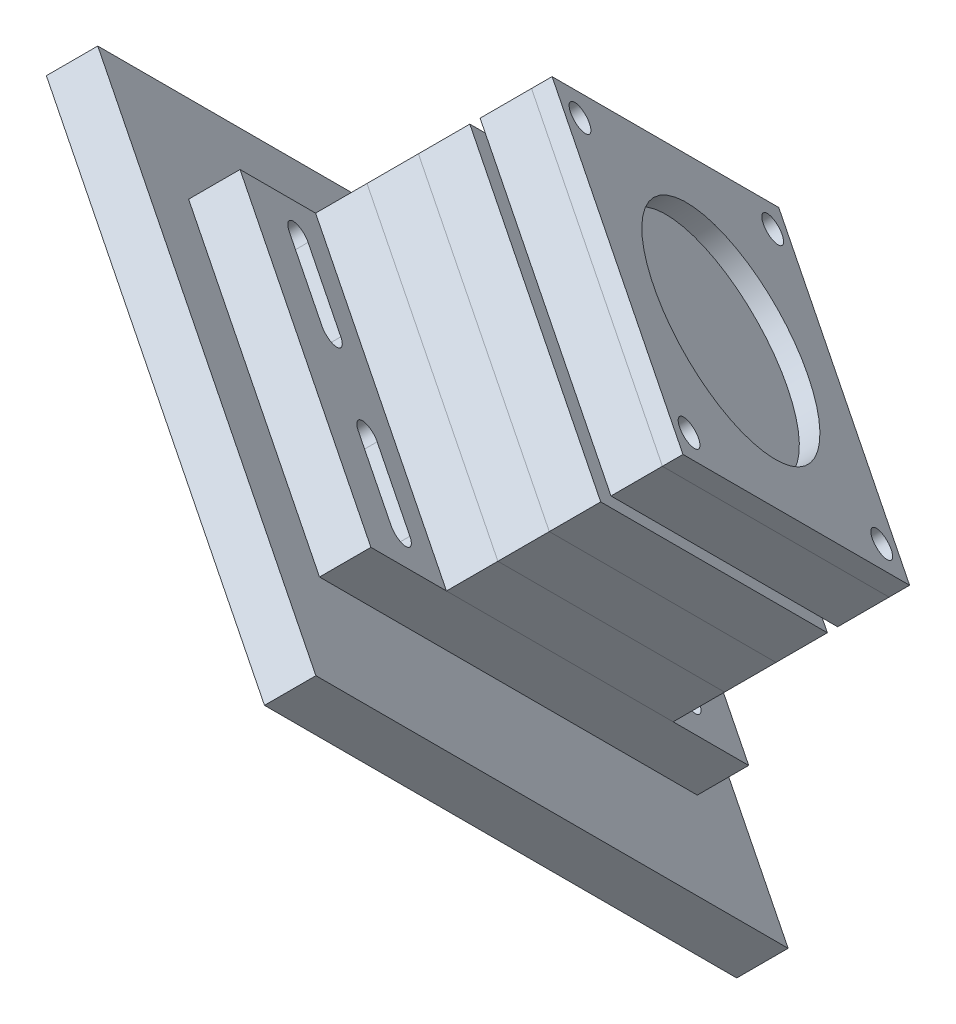
from build123d import *

# Parameters (mm, degrees)
SKETCH1_W            = 80
SKETCH1_H            = 80
BOSS_EXTRUDE1_DEPTH  = 80
SKETCH2_R            = 97.950709898
CUT_EXTRUDE1_DEPTH   = 93.37604307
SKETCH3_R            = 78.302577254
SKETCH3_R_2          = 12.7
CUT_EXTRUDE2_DEPTH   = 40
SKETCH4_R            = 14.105721121
CUT_EXTRUDE3_DEPTH   = 40
SKETCH6_W            = 36
SKETCH6_H            = 36
BOSS_EXTRUDE2_DEPTH  = 5
BOSS_EXTRUDE3_DEPTH  = 5
BOSS_EXTRUDE4_DEPTH  = 5
SKETCH12_R           = 12.7
SKETCH12_R_2         = 1.5
BOSS_EXTRUDE6_DEPTH  = 5
SKETCH15_W           = 36
SKETCH15_H           = 60
SKETCH15_R           = 1.5
BOSS_EXTRUDE8_DEPTH  = 5
SKETCH16_W           = 60
SKETCH16_H           = 75
BOSS_EXTRUDE9_DEPTH  = 5
SKETCH20_R           = 12.25
SKETCH20_R_2         = 1.5
BOSS_EXTRUDE10_DEPTH = 2


with BuildPart() as part:
    # Sketch1 → Boss-Extrude1 (new body)
    with BuildSketch(Plane(origin=(0, 0, 0), x_dir=(1, 0, 0), z_dir=(0, 1, 0))):
        with Locations((40, 40)):
            Rectangle(SKETCH1_W, SKETCH1_H)
    extrude(amount=BOSS_EXTRUDE1_DEPTH)

    # Sketch2 → Cut-Extrude1 (cut, through all)
    with BuildSketch(Plane(origin=(26.666666667, 26.666666667, -26.666666667), x_dir=(-0.8164965809277261, 0.408248290463863, -0.408248290463863), z_dir=(0.5773502691896257, 0.5773502691896258, -0.5773502691896258))):
        Circle(SKETCH2_R)
    extrude(amount=CUT_EXTRUDE1_DEPTH, mode=Mode.SUBTRACT)

    # Sketch3 → Cut-Extrude2 (cut)
    with BuildSketch(Plane(origin=(26.666666667, 26.666666667, -26.666666667), x_dir=(-0.4082482904638628, -0.408248290463863, -0.8164965809277263), z_dir=(0.5773502691896258, 0.577350269189626, -0.5773502691896256))):
        Circle(SKETCH3_R)
        with Locations(Location((0, 0, 0), (0, 0, 90))):
            Circle(SKETCH3_R_2, mode=Mode.SUBTRACT)
    extrude(amount=-CUT_EXTRUDE2_DEPTH, mode=Mode.SUBTRACT)

    # Sketch4 → Cut-Extrude3 (cut)
    with BuildSketch(Plane(origin=(11.547005384, 11.547005384, -11.547005384), x_dir=(-0.816496580927726, 0.408248290463863, -0.408248290463863), z_dir=(0.5773502691896258, 0.5773502691896262, -0.5773502691896255))):
        Circle(SKETCH4_R)
    extrude(amount=CUT_EXTRUDE3_DEPTH, mode=Mode.SUBTRACT)


with BuildPart() as body_2:
    # Sketch6 → Boss-Extrude2 (new body)
    with BuildSketch(Plane(origin=(8.082903769, 8.082903769, -8.082903769), x_dir=(0.8164965809277259, -0.4082482904638634, 0.40824829046386296), z_dir=(0.577350269189626, 0.5773502691896261, -0.5773502691896253))):
        Rectangle(SKETCH6_W, SKETCH6_H)
        with BuildLine():
            Line((11.839413643, -4.595463479), (-1.939918706, -12.55096472))
            ThreePointArc((-1.939918706, -12.55096472), (-6.35, -10.998522628), (-9.899494937, -7.955501241))
            Line((-9.899494937, -7.955501241), (-9.899494937, 7.955501241))
            ThreePointArc((-9.899494937, 7.955501241), (-6.35, 10.998522628), (-1.939918706, 12.55096472))
            Line((-1.939918706, 12.55096472), (11.839413643, 4.595463479))
            ThreePointArc((11.839413643, 4.595463479), (12.7, 0), (11.839413643, -4.595463479))
        make_face(mode=Mode.SUBTRACT)
    extrude(amount=-BOSS_EXTRUDE2_DEPTH)


with BuildPart() as body_3:
    # Sketch7 → Boss-Extrude3 (new body)
    with BuildSketch(Plane(origin=(5.196152423, 5.196152423, -5.196152423), x_dir=(0.4082482904638628, 0.40824829046386274, 0.8164965809277264), z_dir=(-0.5773502691896258, -0.5773502691896261, 0.5773502691896254))):
        Polygon((6.588457268, 24.588457268), (-24.588457268, 6.588457268), (-6.588457268, -24.588457268), (24.588457268, -6.588457268), align=None)
        with BuildLine():
            Line((6.363961031, 10.9904504), (6.363961031, -10.9904504))
            ThreePointArc((6.363961031, -10.9904504), (6.35, -10.998522628), (6.33602873, -11.006577121))
            Line((6.33602873, -11.006577121), (-12.699989761, -0.016126721))
            ThreePointArc((-12.699989761, -0.016126721), (-12.7, 0), (-12.699989761, 0.016126721))
            Line((-12.699989761, 0.016126721), (6.33602873, 11.006577121))
            ThreePointArc((6.33602873, 11.006577121), (6.35, 10.998522628), (6.363961031, 10.9904504))
        make_face(mode=Mode.SUBTRACT)
    extrude(amount=BOSS_EXTRUDE3_DEPTH)


with BuildPart() as body_4:
    # Sketch8 → Boss-Extrude4 (new body)
    with BuildSketch(Plane(origin=(2.309401077, 2.309401077, -2.309401077), x_dir=(0.40824829046386274, 0.4082482904638628, 0.8164965809277264), z_dir=(-0.5773502691896258, -0.5773502691896261, 0.5773502691896254))):
        Polygon((24.588457268, -6.588457268), (6.588457268, 24.588457268), (-24.588457268, 6.588457268), (-6.588457268, -24.588457268), align=None)
        Polygon((-5.656854249, 0), (2.828427125, 4.898979486), (2.828427125, -4.898979486), align=None, mode=Mode.SUBTRACT)
    extrude(amount=BOSS_EXTRUDE4_DEPTH)


with BuildPart() as body_5:
    # Sketch12 → Boss-Extrude6 (new body)
    with BuildSketch(Plane(origin=(11.547005384, 11.547005384, -11.547005384), x_dir=(-0.40824829046386285, -0.40824829046386274, -0.8164965809277263), z_dir=(0.577350269189626, 0.5773502691896261, -0.5773502691896255))):
        Polygon((24.588457268, 6.588457268), (-6.588457268, 24.588457268), (-24.588457268, -6.588457268), (6.588457268, -24.588457268), align=None)
        with Locations(Location((0, 0, 0), (0, 0, 90))):
            Circle(SKETCH12_R, mode=Mode.SUBTRACT)
        with Locations(Location((20.750188678, 5.340381057, 0), (0, 0, 90))):
            Circle(SKETCH12_R_2, mode=Mode.SUBTRACT)
        with Locations(Location((-5.750188678, 20.640381057, 0), (0, 0, 90))):
            Circle(SKETCH12_R_2, mode=Mode.SUBTRACT)
        with Locations(Location((-20.750188678, -5.340381057, 0), (0, 0, 90))):
            Circle(SKETCH12_R_2, mode=Mode.SUBTRACT)
        with Locations(Location((5.750188678, -20.640381057, 0), (0, 0, 90))):
            Circle(SKETCH12_R_2, mode=Mode.SUBTRACT)
    extrude(amount=-BOSS_EXTRUDE6_DEPTH)


with BuildPart() as body_6:
    # Sketch15 → Boss-Extrude8 (new body)
    with BuildSketch(Plane(origin=(-0.577350269189621, -0.5773502691896211, 0.5773502691896204), x_dir=(-0.8164965809277259, 0.4082482904638634, -0.4082482904638631), z_dir=(-0.5773502691896261, -0.5773502691896256, 0.5773502691896257))):
        Rectangle(SKETCH15_W, SKETCH15_H)
        with Locations(Location((15, 15.3, 0), (0, 0, 210))):
            Circle(SKETCH15_R, mode=Mode.SUBTRACT)
        with Locations(Location((-15, 15.3, 0), (0, 0, 210))):
            Circle(SKETCH15_R, mode=Mode.SUBTRACT)
        with Locations(Location((-15, -15.3, 0), (0, 0, 210))):
            Circle(SKETCH15_R, mode=Mode.SUBTRACT)
        with Locations(Location((15, -15.3, 0), (0, 0, 210))):
            Circle(SKETCH15_R, mode=Mode.SUBTRACT)
        with BuildLine():
            Line((-14, 24.5), (-5, 24.5))
            ThreePointArc((-5, 24.5), (-3.5, 23), (-5, 21.5))
            Line((-5, 21.5), (-14, 21.5))
            ThreePointArc((-14, 21.5), (-15.5, 23), (-14, 24.5))
        make_face(mode=Mode.SUBTRACT)
        with BuildLine():
            Line((14, 24.5), (5, 24.5))
            ThreePointArc((5, 24.5), (3.5, 23), (5, 21.5))
            Line((5, 21.5), (14, 21.5))
            ThreePointArc((14, 21.5), (15.5, 23), (14, 24.5))
        make_face(mode=Mode.SUBTRACT)
        with BuildLine():
            Line((14, -24.5), (5, -24.5))
            ThreePointArc((5, -24.5), (3.5, -23), (5, -21.5))
            Line((5, -21.5), (14, -21.5))
            ThreePointArc((14, -21.5), (15.5, -23), (14, -24.5))
        make_face(mode=Mode.SUBTRACT)
        with BuildLine():
            Line((-14, -24.5), (-5, -24.5))
            ThreePointArc((-5, -24.5), (-3.5, -23), (-5, -21.5))
            Line((-5, -21.5), (-14, -21.5))
            ThreePointArc((-14, -21.5), (-15.5, -23), (-14, -24.5))
        make_face(mode=Mode.SUBTRACT)
    extrude(amount=BOSS_EXTRUDE8_DEPTH)


with BuildPart() as body_7:
    # Sketch16 → Boss-Extrude9 (new body)
    with BuildSketch(Plane(origin=(-3.464101615, -3.464101615, 3.464101615), x_dir=(-0.8164965809277259, 0.4082482904638634, -0.4082482904638631), z_dir=(-0.5773502691896261, -0.5773502691896256, 0.5773502691896257))):
        Rectangle(SKETCH16_W, SKETCH16_H)
        with BuildLine():
            Line((-11, 18.5), (-11, 27.5))
            ThreePointArc((-11, 27.5), (-9.5, 29), (-8, 27.5))
            Line((-8, 27.5), (-8, 18.5))
            ThreePointArc((-8, 18.5), (-9.5, 17), (-11, 18.5))
        make_face(mode=Mode.SUBTRACT)
        with BuildLine():
            Line((11, 18.5), (11, 27.5))
            ThreePointArc((11, 27.5), (9.5, 29), (8, 27.5))
            Line((8, 27.5), (8, 18.5))
            ThreePointArc((8, 18.5), (9.5, 17), (11, 18.5))
        make_face(mode=Mode.SUBTRACT)
        with BuildLine():
            Line((-11, -18.5), (-11, -27.5))
            ThreePointArc((-11, -27.5), (-9.5, -29), (-8, -27.5))
            Line((-8, -27.5), (-8, -18.5))
            ThreePointArc((-8, -18.5), (-9.5, -17), (-11, -18.5))
        make_face(mode=Mode.SUBTRACT)
        with BuildLine():
            Line((8, -27.5), (8, -18.5))
            ThreePointArc((8, -18.5), (9.5, -17), (11, -18.5))
            Line((11, -18.5), (11, -27.5))
            ThreePointArc((11, -27.5), (9.5, -29), (8, -27.5))
        make_face(mode=Mode.SUBTRACT)
    extrude(amount=BOSS_EXTRUDE9_DEPTH)


with BuildPart() as body_8:
    # Sketch20 → Boss-Extrude10 (new body)
    with BuildSketch(Plane(origin=(11.547005384, 11.547005384, -11.547005384), x_dir=(-0.4082482904638628, -0.4082482904638628, -0.8164965809277264), z_dir=(0.577350269189626, 0.577350269189626, -0.5773502691896254))):
        Polygon((6.588457268, -24.588457268), (24.588457268, 6.588457268), (-6.588457268, 24.588457268), (-24.588457268, -6.588457268), align=None)
        with Locations(Location((0, 0, 0), (0, 0, 90))):
            Circle(SKETCH20_R, mode=Mode.SUBTRACT)
        with Locations(Location((20.750188678, 5.340381057, 0), (0, 0, 90))):
            Circle(SKETCH20_R_2, mode=Mode.SUBTRACT)
        with Locations(Location((-5.750188678, 20.640381057, 0), (0, 0, 90))):
            Circle(SKETCH20_R_2, mode=Mode.SUBTRACT)
        with Locations(Location((-20.750188678, -5.340381057, 0), (0, 0, 90))):
            Circle(SKETCH20_R_2, mode=Mode.SUBTRACT)
        with Locations(Location((5.750188678, -20.640381057, 0), (0, 0, 90))):
            Circle(SKETCH20_R_2, mode=Mode.SUBTRACT)
    extrude(amount=BOSS_EXTRUDE10_DEPTH)


solid = Compound([part.part, body_2.part, body_3.part, body_4.part, body_5.part, body_6.part, body_7.part, body_8.part])
